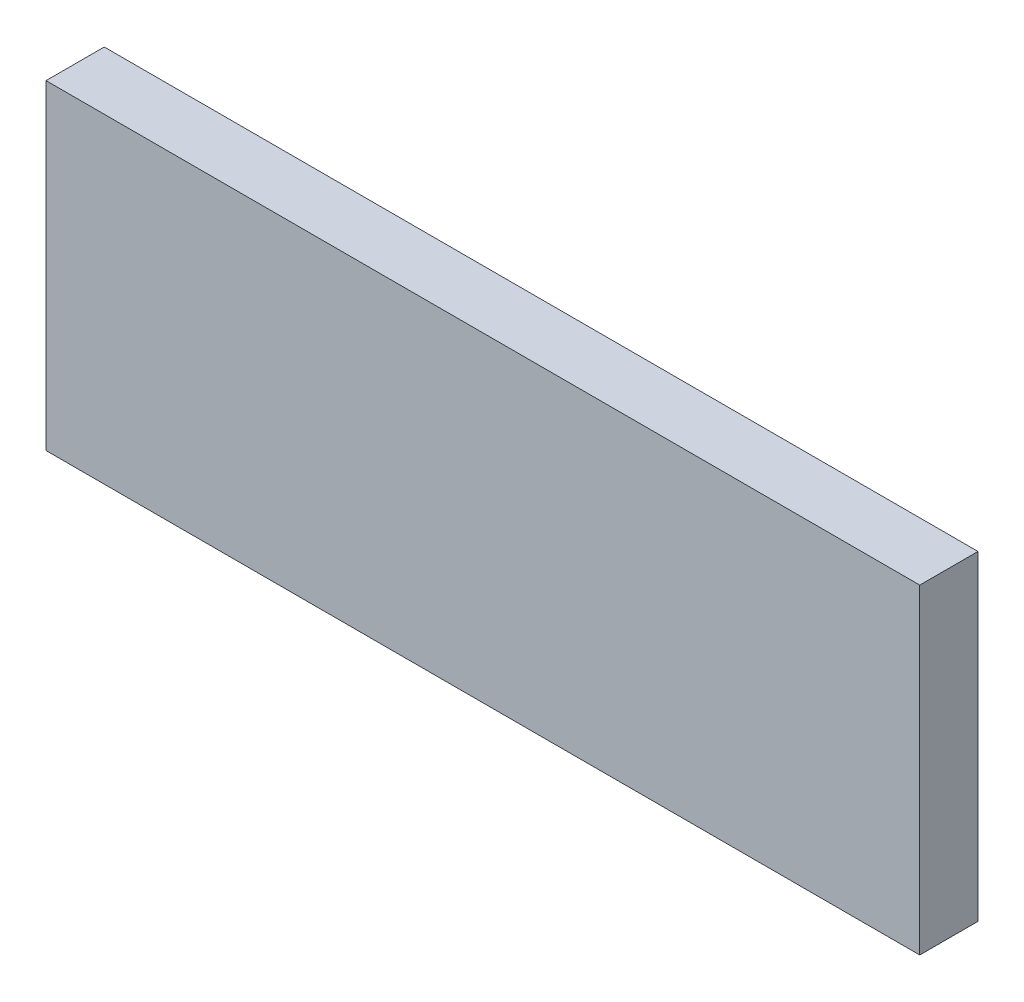
from build123d import *

# Parameters (mm, degrees)
SKETCH1_W           = 30
SKETCH1_H           = 11
BOSS_EXTRUDE1_DEPTH = 2


with BuildPart() as part:
    # Sketch1 → Boss-Extrude1 (new body)
    with BuildSketch(Plane.XY):
        with Locations((-36.24, 26.08)):
            Rectangle(SKETCH1_W, SKETCH1_H)
    extrude(amount=BOSS_EXTRUDE1_DEPTH)


solid = part.part
